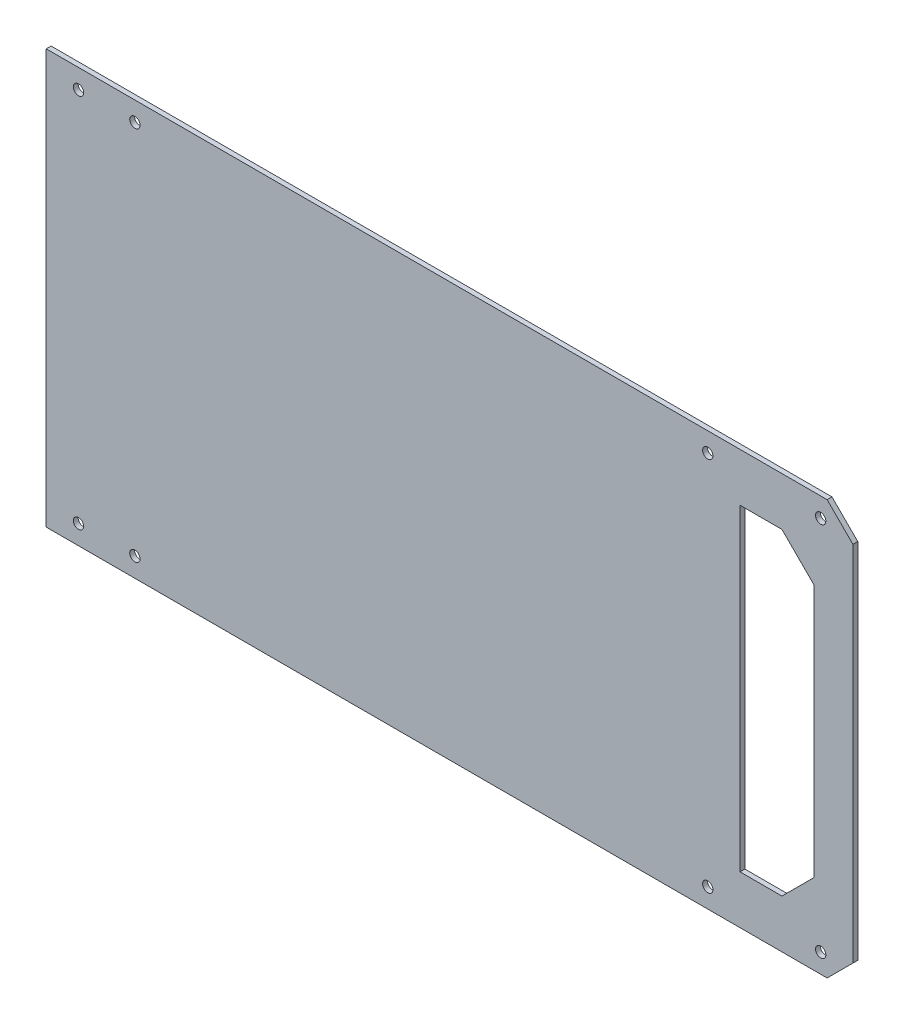
from build123d import *

# Parameters (mm, degrees)
BOSS_EXTRUDE1_DEPTH = 1.5
SKETCH2_R           = 1.6
CUT_EXTRUDE1_DEPTH  = 3.5


with BuildPart() as part:
    # Sketch1 → Boss-Extrude1 (new body)
    with BuildSketch(Plane.XY):
        Polygon((-586.414001465, 117.914742868), (-828.47776474, 117.914742868), (-828.47776474, -10.5), (-586.414001465, -10.5), (-578.414001465, -2.5), (-578.414001465, 109.914742868), align=None)
        Polygon((-613.414001465, 4.5), (-600.414001465, 4.5), (-590.414001465, 14.5), (-590.414001465, 92.914742868), (-600.414001465, 102.914742868), (-613.414001465, 102.914742868), align=None, mode=Mode.SUBTRACT)
    extrude(amount=BOSS_EXTRUDE1_DEPTH)

    # Sketch2 → Cut-Extrude1 (cut)
    with BuildSketch(Plane.XY.offset(1.5)):
        with Locations((-818.47776474, -4.5)):
            Circle(SKETCH2_R)
        with Locations((-800.992483366, -4.5)):
            Circle(SKETCH2_R)
        with Locations((-623.414001465, -4.5)):
            Circle(SKETCH2_R)
        with Locations((-588.414001465, -4.5)):
            Circle(SKETCH2_R)
        with Locations((-623.414001465, 111.914742868)):
            Circle(SKETCH2_R)
        with Locations((-588.414001465, 111.914742868)):
            Circle(SKETCH2_R)
        with Locations((-818.47776474, 111.914742868)):
            Circle(SKETCH2_R)
        with Locations((-800.992483366, 111.914742868)):
            Circle(SKETCH2_R)
    extrude(amount=-CUT_EXTRUDE1_DEPTH, mode=Mode.SUBTRACT)


solid = part.part
